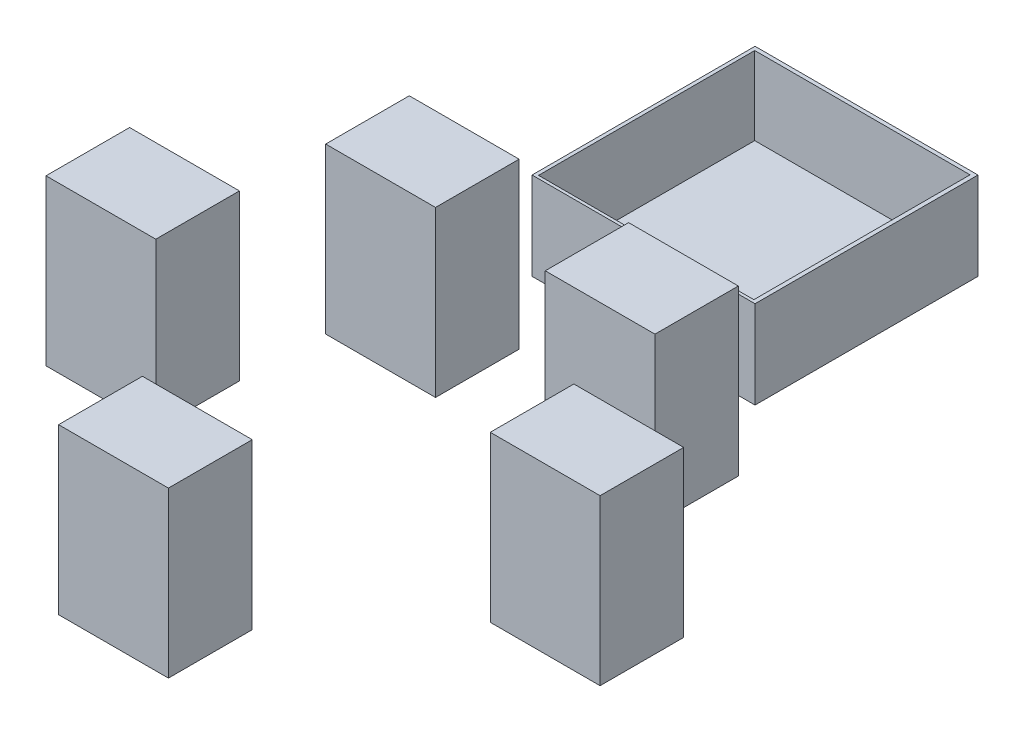
from build123d import *

# Parameters (mm, degrees)
SKETCH1_W             = 101.6
SKETCH1_H             = 101.6
BOSS_EXTRUDE1_DEPTH   = 39.99992
SKETCH2_W             = 98.115054024
SKETCH2_H             = 98.519374302
CUT_EXTRUDE1_DEPTH    = 35.56
SKETCH3_W             = 49.9999
SKETCH3_H             = 37.999924
BOSS_EXTRUDE2_DEPTH   = 75.000104
SKETCH3_W_2           = 50.038
SKETCH3_H_2           = 38.1
BOSS_EXTRUDE2_2_DEPTH = 75.000104
BOSS_EXTRUDE2_3_DEPTH = 75.000104
BOSS_EXTRUDE2_4_DEPTH = 75.000104
SKETCH3_W_3           = 50.044709845
SKETCH3_H_3           = 38.200481576
BOSS_EXTRUDE2_5_DEPTH = 75.000104
SKETCH4_W             = 47.673303357
SKETCH4_H             = 36.001078641
SKETCH4_W_2           = 47.329126014
SKETCH4_H_2           = 35.49131434
SKETCH4_W_3           = 47.385353059
SKETCH4_H_3           = 34.904518915
SKETCH4_W_4           = 47.458878428
SKETCH4_W_5           = 48.104938799
SKETCH4_H_4           = 35.956464733
CUT_EXTRUDE2_DEPTH    = 73.222104
SKETCH5_R             = 9.906
SKETCH5_R_2           = 9.962701018
CUT_EXTRUDE3_DEPTH    = 9.722104
SKETCH6_R             = 9.906
CUT_EXTRUDE4_DEPTH    = 9.722104
SKETCH7_R             = 9.906
CUT_EXTRUDE5_DEPTH    = 9.722104


with BuildPart() as part:
    # Sketch1 → Boss-Extrude1 (new body)
    with BuildSketch(Plane(origin=(0, 0, 0), x_dir=(1, 0, 0), z_dir=(0, 1, 0))):
        with Locations((50.8, 50.8)):
            Rectangle(SKETCH1_W, SKETCH1_H)
    extrude(amount=BOSS_EXTRUDE1_DEPTH)

    # Sketch2 → Cut-Extrude1 (cut)
    with BuildSketch(Plane(origin=(0, 39.99992, 0), x_dir=(1, 0, 0), z_dir=(0, 1, 0))):
        with Locations((50.665226574, 50.597839861)):
            Rectangle(SKETCH2_W, SKETCH2_H)
    extrude(amount=-CUT_EXTRUDE1_DEPTH, mode=Mode.SUBTRACT)


with BuildPart() as body_2:
    # Sketch3 → Boss-Extrude2 (new body)
    with BuildSketch(Plane.XZ):
        with Locations((100.7999508, 50.8000254)):
            Rectangle(SKETCH3_W, SKETCH3_H)
    extrude(amount=-BOSS_EXTRUDE2_DEPTH)


with BuildPart() as body_3:
    # Sketch3 → Boss-Extrude2 2 (new body)
    with BuildSketch(Plane.XZ):
        with Locations((0.7809992, 50.7499874)):
            Rectangle(SKETCH3_W_2, SKETCH3_H_2)
    extrude(amount=-BOSS_EXTRUDE2_2_DEPTH)


with BuildPart() as body_4:
    # Sketch3 → Boss-Extrude2 3 (new body)
    with BuildSketch(Plane.XZ):
        with Locations((152.019, 127)):
            Rectangle(SKETCH3_W_2, SKETCH3_H_2)
    extrude(amount=-BOSS_EXTRUDE2_3_DEPTH)


with BuildPart() as body_5:
    # Sketch3 → Boss-Extrude2 4 (new body)
    with BuildSketch(Plane.XZ):
        with Locations((-50.419, 127)):
            Rectangle(SKETCH3_W_2, SKETCH3_H_2)
    extrude(amount=-BOSS_EXTRUDE2_4_DEPTH)


with BuildPart() as body_6:
    # Sketch3 → Boss-Extrude2 5 (new body)
    with BuildSketch(Plane.XZ):
        with Locations((50.669645078, 222.300240788)):
            Rectangle(SKETCH3_W_3, SKETCH3_H_3)
    extrude(amount=-BOSS_EXTRUDE2_5_DEPTH)


with BuildPart() as cut_extrude2_tool:
    # Sketch4 → Cut-Extrude2 (new body)
    with BuildSketch(Plane.XZ):
        with Locations((-50.459366902, 126.988435685)):
            Rectangle(SKETCH4_W, SKETCH4_H)
        with Locations((0.970104392, 50.412109166)):
            Rectangle(SKETCH4_W_2, SKETCH4_H_2)
        with Locations((100.689433749, 50.705506879)):
            Rectangle(SKETCH4_W_3, SKETCH4_H_3)
        with Locations((152.233471247, 126.988435685)):
            Rectangle(SKETCH4_W_4, SKETCH4_H)
        with Locations((50.616530906, 222.262061552)):
            Rectangle(SKETCH4_W_5, SKETCH4_H_4)
    extrude(amount=-CUT_EXTRUDE2_DEPTH)


with BuildPart() as body_2_1:
    add(body_2.part)

    # Cut-Extrude2: cut by cut_extrude2_tool
    add(cut_extrude2_tool.part, mode=Mode.SUBTRACT)


with BuildPart() as body_3_1:
    add(body_3.part)

    # Cut-Extrude2: cut by cut_extrude2_tool
    add(cut_extrude2_tool.part, mode=Mode.SUBTRACT)


with BuildPart() as body_4_1:
    add(body_4.part)

    # Cut-Extrude2: cut by cut_extrude2_tool
    add(cut_extrude2_tool.part, mode=Mode.SUBTRACT)


with BuildPart() as body_5_1:
    add(body_5.part)

    # Cut-Extrude2: cut by cut_extrude2_tool
    add(cut_extrude2_tool.part, mode=Mode.SUBTRACT)


with BuildPart() as body_6_1:
    add(body_6.part)

    # Cut-Extrude2: cut by cut_extrude2_tool
    add(cut_extrude2_tool.part, mode=Mode.SUBTRACT)

    # Sketch7 → Cut-Extrude5 (cut)
    with BuildSketch(Plane(origin=(0, 0, 203.2), x_dir=(-1, 0, 0), z_dir=(0, 0, -1))):
        with Locations((-50.669645078, 54.934104)):
            Circle(SKETCH7_R)
    extrude(amount=-CUT_EXTRUDE5_DEPTH, mode=Mode.SUBTRACT)


with BuildPart() as cut_extrude3_tool:
    # Sketch5 → Cut-Extrude3 (new body)
    with BuildSketch(Plane(origin=(0, 0, 31.6999874), x_dir=(-1, 0, 0), z_dir=(0, 0, -1))):
        with Locations((-0.7809992, 54.934104)):
            Circle(SKETCH5_R)
        with Locations((-100.7999508, 54.934104)):
            Circle(SKETCH5_R_2)
    extrude(amount=-CUT_EXTRUDE3_DEPTH)


with BuildPart() as body_2_2:
    add(body_2_1.part)

    # Cut-Extrude3: cut by cut_extrude3_tool
    add(cut_extrude3_tool.part, mode=Mode.SUBTRACT)


with BuildPart() as body_3_2:
    add(body_3_1.part)

    # Cut-Extrude3: cut by cut_extrude3_tool
    add(cut_extrude3_tool.part, mode=Mode.SUBTRACT)


with BuildPart() as cut_extrude4_tool:
    # Sketch6 → Cut-Extrude4 (new body)
    with BuildSketch(Plane(origin=(0, 0, 107.95), x_dir=(-1, 0, 0), z_dir=(0, 0, -1))):
        with Locations((-152.019, 54.934104)):
            Circle(SKETCH6_R)
        with Locations((50.419, 54.934104)):
            Circle(SKETCH6_R)
    extrude(amount=-CUT_EXTRUDE4_DEPTH)


with BuildPart() as body_4_2:
    add(body_4_1.part)

    # Cut-Extrude4: cut by cut_extrude4_tool
    add(cut_extrude4_tool.part, mode=Mode.SUBTRACT)


with BuildPart() as body_5_2:
    add(body_5_1.part)

    # Cut-Extrude4: cut by cut_extrude4_tool
    add(cut_extrude4_tool.part, mode=Mode.SUBTRACT)


solid = Compound([part.part, body_6_1.part, body_2_2.part, body_3_2.part, body_4_2.part, body_5_2.part])
